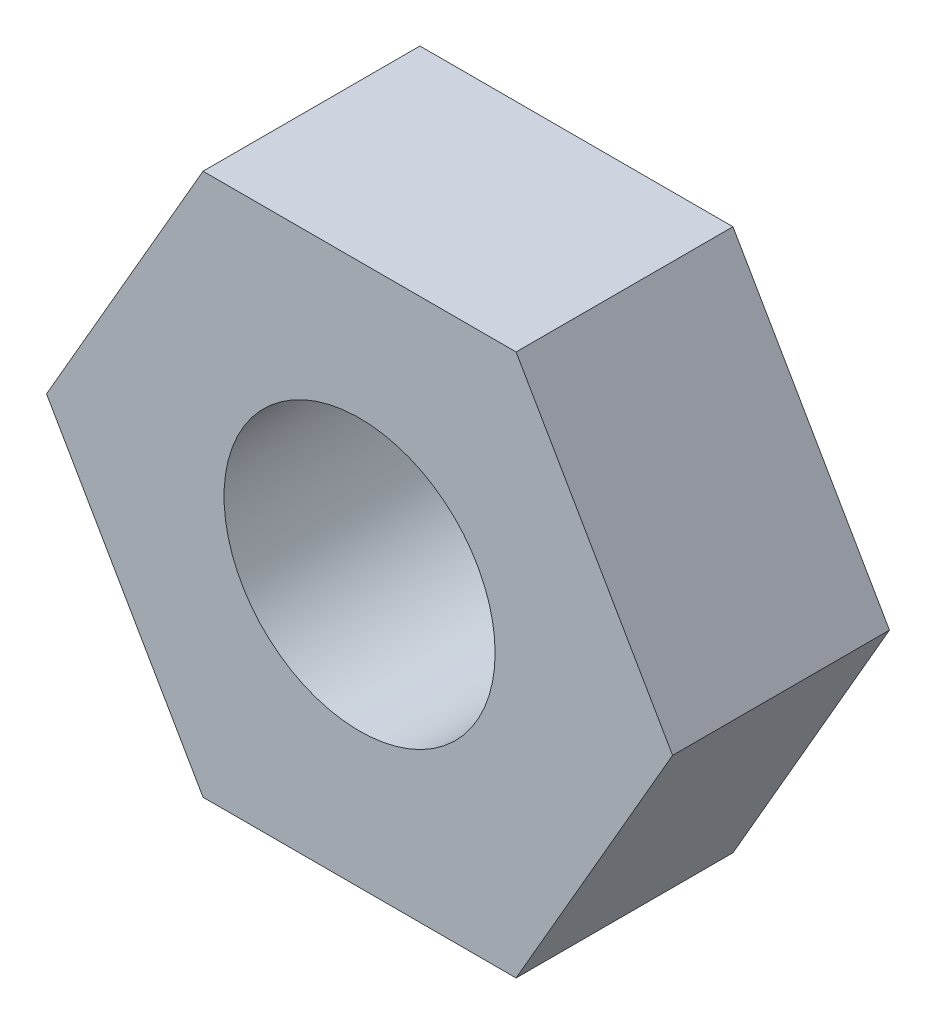
from build123d import *

# Parameters (mm, degrees)
ACROSS_FLATS_4_R                     = 1
NUT_THREAD_ENVELOPE_HEIGHT_1_6_DEPTH = 1.6


with BuildPart() as part:
    # Across_flats_4 → Nut_thread_envelope_height_1.6 (new body)
    with BuildSketch(Plane.XY):
        Polygon((2.309401077, 0), (1.154700538, 2), (-1.154700538, 2), (-2.309401077, 0), (-1.154700538, -2), (1.154700538, -2), align=None)
        Circle(ACROSS_FLATS_4_R, mode=Mode.SUBTRACT)
    extrude(amount=NUT_THREAD_ENVELOPE_HEIGHT_1_6_DEPTH)


solid = part.part
